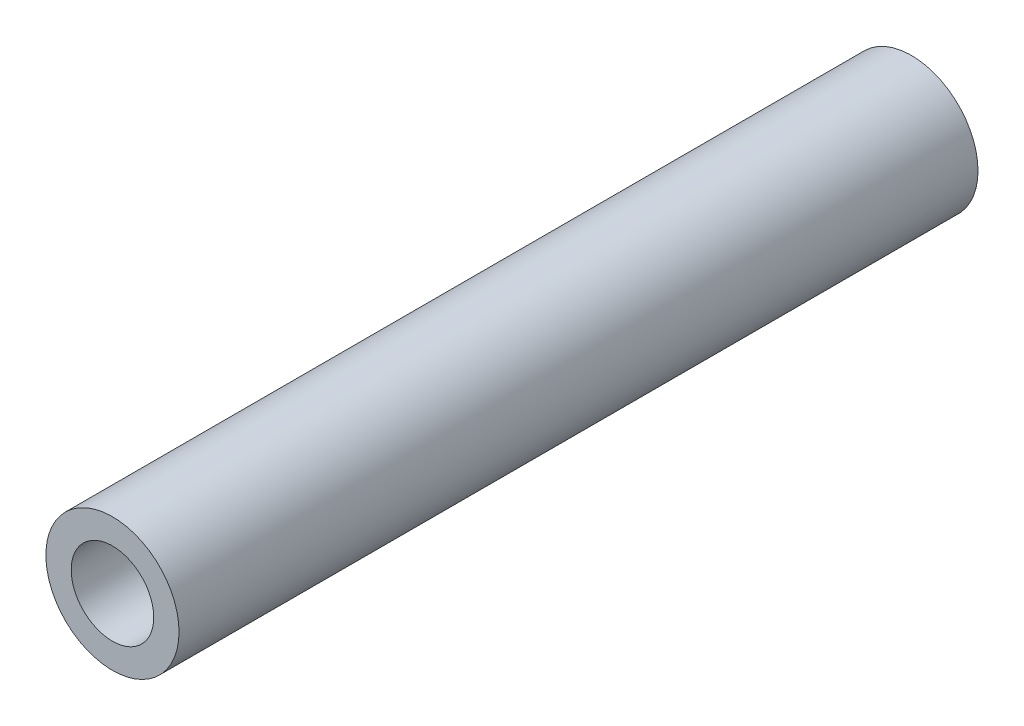
from build123d import *

# Parameters (mm, degrees)
SKETCH_1_R      = 2.5
SKETCH_1_R_2    = 1.55
EXTRUDE_1_DEPTH = 30


with BuildPart() as part:
    # 草图1 → 凸台-拉伸1 (new body)
    with BuildSketch(Plane.XY):
        Circle(SKETCH_1_R)
        Circle(SKETCH_1_R_2, mode=Mode.SUBTRACT)
    extrude(amount=EXTRUDE_1_DEPTH)


solid = part.part
